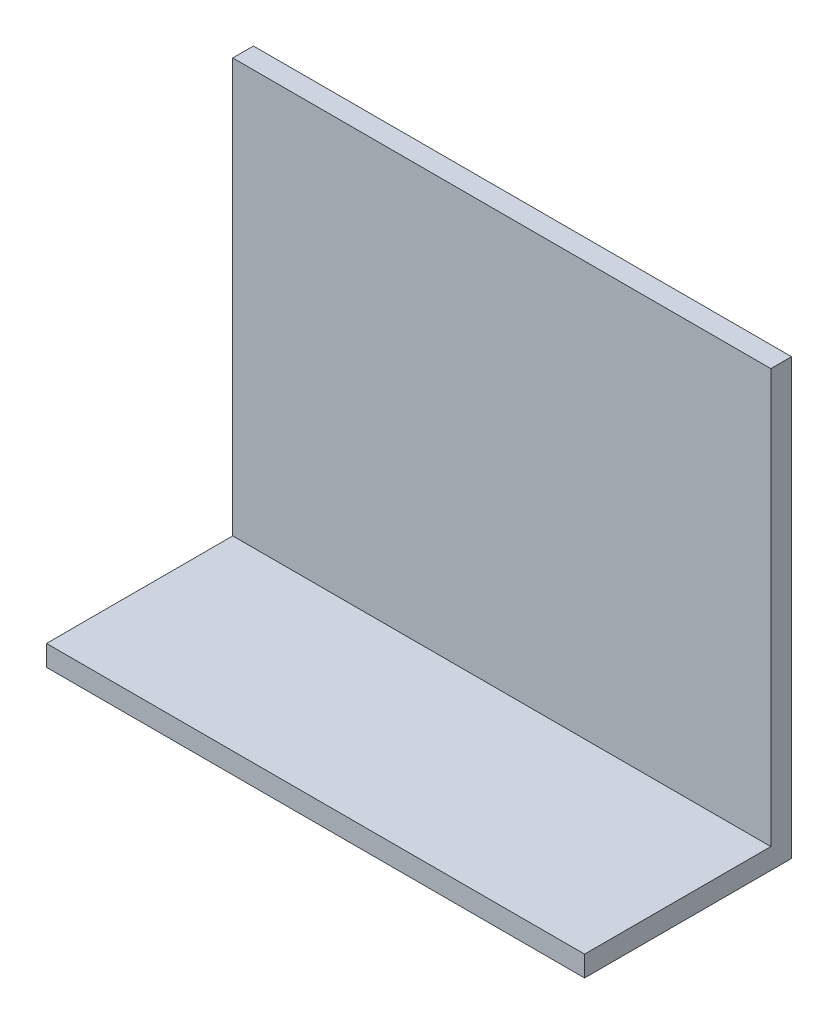
from build123d import *

# Parameters (mm, degrees)
ESQUISSE1_W             = 52
ESQUISSE1_H             = 42
BOSS_EXTRU_1_DEPTH      = 20
ESQUISSE2_W             = 66.008627658
ESQUISSE2_H             = 40.946179855
ENL_V_MAT_EXTRU_1_DEPTH = 40


with BuildPart() as part:
    # Esquisse1 → Boss.-Extru.1 (new body)
    with BuildSketch(Plane.XY):
        Rectangle(ESQUISSE1_W, ESQUISSE1_H)
    extrude(amount=BOSS_EXTRU_1_DEPTH)

    # Esquisse2 → Enlèv. mat.-Extru.1 (cut)
    with BuildSketch(Plane(origin=(0, 21, 0), x_dir=(1, 0, 0), z_dir=(0, 1, 0))):
        with Locations((1.405901571, -22.473089928)):
            Rectangle(ESQUISSE2_W, ESQUISSE2_H)
    extrude(amount=-ENL_V_MAT_EXTRU_1_DEPTH, mode=Mode.SUBTRACT)


solid = part.part
